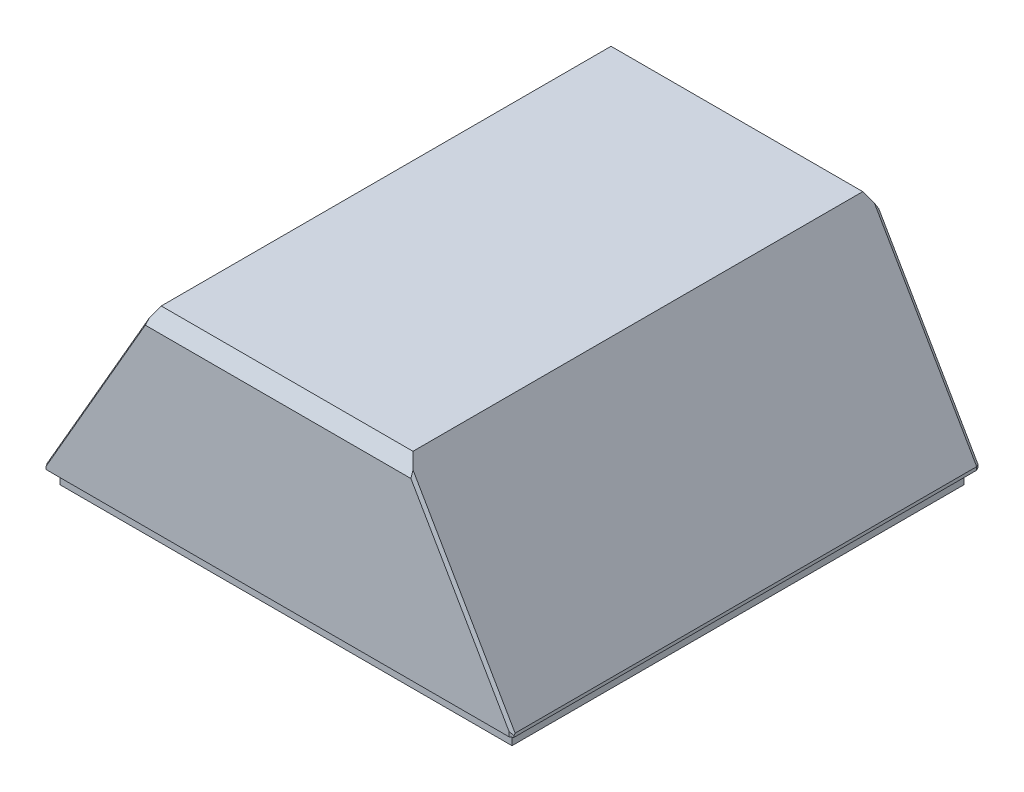
from build123d import *
from OCP.BRepFilletAPI import BRepFilletAPI_MakeChamfer

# Parameters (mm, degrees)
SKETCH1_W           = 150
SKETCH1_H           = 150
BOSS_EXTRUDE1_DEPTH = 1
SKETCH2_W           = 150
SKETCH2_H           = 150
BOSS_EXTRUDE2_DEPTH = 60
CHAMFER1_SIZE       = 60
CHAMFER1_SIZE2      = 34.641016151
CHAMFER2_SIZE       = 5
CHAMFER2_SIZE2      = 2.886751346
CHAMFER3_SIZE       = 1
CHAMFER3_SIZE2      = 0.577350269
CHAMFER4_SIZE       = 1
CHAMFER4_SIZE2      = 0.577350269
SKETCH3_W           = 145
SKETCH3_H           = 145
BOSS_EXTRUDE3_DEPTH = 4.5


with BuildPart() as part:
    # Sketch1 → Boss-Extrude1 (new body)
    with BuildSketch(Plane(origin=(0, 0, 0), x_dir=(1, 0, 0), z_dir=(0, 1, 0))):
        Rectangle(SKETCH1_W, SKETCH1_H)
    extrude(amount=BOSS_EXTRUDE1_DEPTH)

    # Sketch2 → Boss-Extrude2 (add)
    with BuildSketch(Plane(origin=(0, 1, 0), x_dir=(1, 0, 0), z_dir=(0, 1, 0))):
        Rectangle(SKETCH2_W, SKETCH2_H)
    extrude(amount=BOSS_EXTRUDE2_DEPTH)

    # Chamfer1: one chamfer whose edges measure the first distance from different faces: ONE call of the kernel's chamfer builder (chamfer() names one face for all edges)
    chamfer1_edges_1 = [part.edges().sort_by_distance(p)[0] for p in [
        (75, 61, 0),
    ]]
    chamfer1_side_1 = [part.faces().sort_by_distance(p)[0] for p in [
        (75, 30.5, 0),
    ]]
    chamfer1_edges_2 = [part.edges().sort_by_distance(p)[0] for p in [
        (-75, 61, 0),
    ]]
    chamfer1_side_2 = [part.faces().sort_by_distance(p)[0] for p in [
        (-75, 30.5, 0),
    ]]
    chamfer1 = BRepFilletAPI_MakeChamfer(part.part.solid().wrapped)
    for e in chamfer1_edges_1:
        chamfer1.Add(CHAMFER1_SIZE, CHAMFER1_SIZE2, e.wrapped, chamfer1_side_1[0].wrapped)  # the first distance lies on this face
    for e in chamfer1_edges_2:
        chamfer1.Add(CHAMFER1_SIZE, CHAMFER1_SIZE2, e.wrapped, chamfer1_side_2[0].wrapped)  # the first distance lies on this face
    add(Compound.cast(chamfer1.Shape()), mode=Mode.REPLACE)

    # Chamfer2: one chamfer whose edges measure the first distance from different faces: ONE call of the kernel's chamfer builder (chamfer() names one face for all edges)
    chamfer2_edges_1 = [part.edges().sort_by_distance(p)[0] for p in [
        (0, 61, -75),
    ]]
    chamfer2_side_1 = [part.faces().sort_by_distance(p)[0] for p in [
        (0, 27.413848587, -75),
    ]]
    chamfer2_edges_2 = [part.edges().sort_by_distance(p)[0] for p in [
        (0, 61, 75),
    ]]
    chamfer2_side_2 = [part.faces().sort_by_distance(p)[0] for p in [
        (0, 27.413848587, 75),
    ]]
    chamfer2 = BRepFilletAPI_MakeChamfer(part.part.solid().wrapped)
    for e in chamfer2_edges_1:
        chamfer2.Add(CHAMFER2_SIZE, CHAMFER2_SIZE2, e.wrapped, chamfer2_side_1[0].wrapped)  # the first distance lies on this face
    for e in chamfer2_edges_2:
        chamfer2.Add(CHAMFER2_SIZE, CHAMFER2_SIZE2, e.wrapped, chamfer2_side_2[0].wrapped)  # the first distance lies on this face
    add(Compound.cast(chamfer2.Shape()), mode=Mode.REPLACE)

    # Chamfer3: one chamfer whose edges measure the first distance from different faces: ONE call of the kernel's chamfer builder (chamfer() names one face for all edges)
    chamfer3_edges_1 = [part.edges().sort_by_distance(p)[0] for p in [
        (-75, 0.5, -75),
    ]]
    chamfer3_side_1 = [part.faces().sort_by_distance(p)[0] for p in [
        (0, 25.462591876, -75),
    ]]
    chamfer3_edges_2 = [part.edges().sort_by_distance(p)[0] for p in [
        (75, 0.5, -75),
    ]]
    chamfer3_side_2 = [part.faces().sort_by_distance(p)[0] for p in [
        (75, 0.5, 0),
    ]]
    chamfer3_edges_3 = [part.edges().sort_by_distance(p)[0] for p in [
        (75, 0.5, 75),
    ]]
    chamfer3_side_3 = [part.faces().sort_by_distance(p)[0] for p in [
        (0, 25.462591876, 75),
    ]]
    chamfer3_edges_4 = [part.edges().sort_by_distance(p)[0] for p in [
        (-75, 0.5, 75),
    ]]
    chamfer3_side_4 = [part.faces().sort_by_distance(p)[0] for p in [
        (-75, 0.5, 0),
    ]]
    chamfer3 = BRepFilletAPI_MakeChamfer(part.part.solid().wrapped)
    for e in chamfer3_edges_1:
        chamfer3.Add(CHAMFER3_SIZE, CHAMFER3_SIZE2, e.wrapped, chamfer3_side_1[0].wrapped)  # the first distance lies on this face
    for e in chamfer3_edges_2:
        chamfer3.Add(CHAMFER3_SIZE, CHAMFER3_SIZE2, e.wrapped, chamfer3_side_2[0].wrapped)  # the first distance lies on this face
    for e in chamfer3_edges_3:
        chamfer3.Add(CHAMFER3_SIZE, CHAMFER3_SIZE2, e.wrapped, chamfer3_side_3[0].wrapped)  # the first distance lies on this face
    for e in chamfer3_edges_4:
        chamfer3.Add(CHAMFER3_SIZE, CHAMFER3_SIZE2, e.wrapped, chamfer3_side_4[0].wrapped)  # the first distance lies on this face
    add(Compound.cast(chamfer3.Shape()), mode=Mode.REPLACE)

    # Chamfer4: one chamfer whose edges measure the first distance from different faces: ONE call of the kernel's chamfer builder (chamfer() names one face for all edges)
    chamfer4_edges_1 = [part.edges().sort_by_distance(p)[0] for p in [
        (-58.622867597, 29.366025404, -75),
        (-58.834192463, 29, 75),
    ]]
    chamfer4_side_1 = [part.faces().sort_by_distance(p)[0] for p in [
        (-57.703873012, 30.957770718, 7.84e-06),
    ]]
    chamfer4_edges_2 = [part.edges().sort_by_distance(p)[0] for p in [
        (58.834192463, 29, -75),
        (58.622867597, 29.366025404, 75),
    ]]
    chamfer4_side_2 = [part.faces().sort_by_distance(p)[0] for p in [
        (57.703873012, 30.957770718, -7.84e-06),
    ]]
    chamfer4 = BRepFilletAPI_MakeChamfer(part.part.solid().wrapped)
    for e in chamfer4_edges_1:
        chamfer4.Add(CHAMFER4_SIZE, CHAMFER4_SIZE2, e.wrapped, chamfer4_side_1[0].wrapped)  # the first distance lies on this face
    for e in chamfer4_edges_2:
        chamfer4.Add(CHAMFER4_SIZE, CHAMFER4_SIZE2, e.wrapped, chamfer4_side_2[0].wrapped)  # the first distance lies on this face
    add(Compound.cast(chamfer4.Shape()), mode=Mode.REPLACE)

    # Sketch3 → Boss-Extrude3 (add)
    with BuildSketch(Plane(origin=(0, 0, 0), x_dir=(-1, 0, 0), z_dir=(0, -1, 0))):
        Rectangle(SKETCH3_W, SKETCH3_H)
    extrude(amount=BOSS_EXTRUDE3_DEPTH)


solid = part.part
